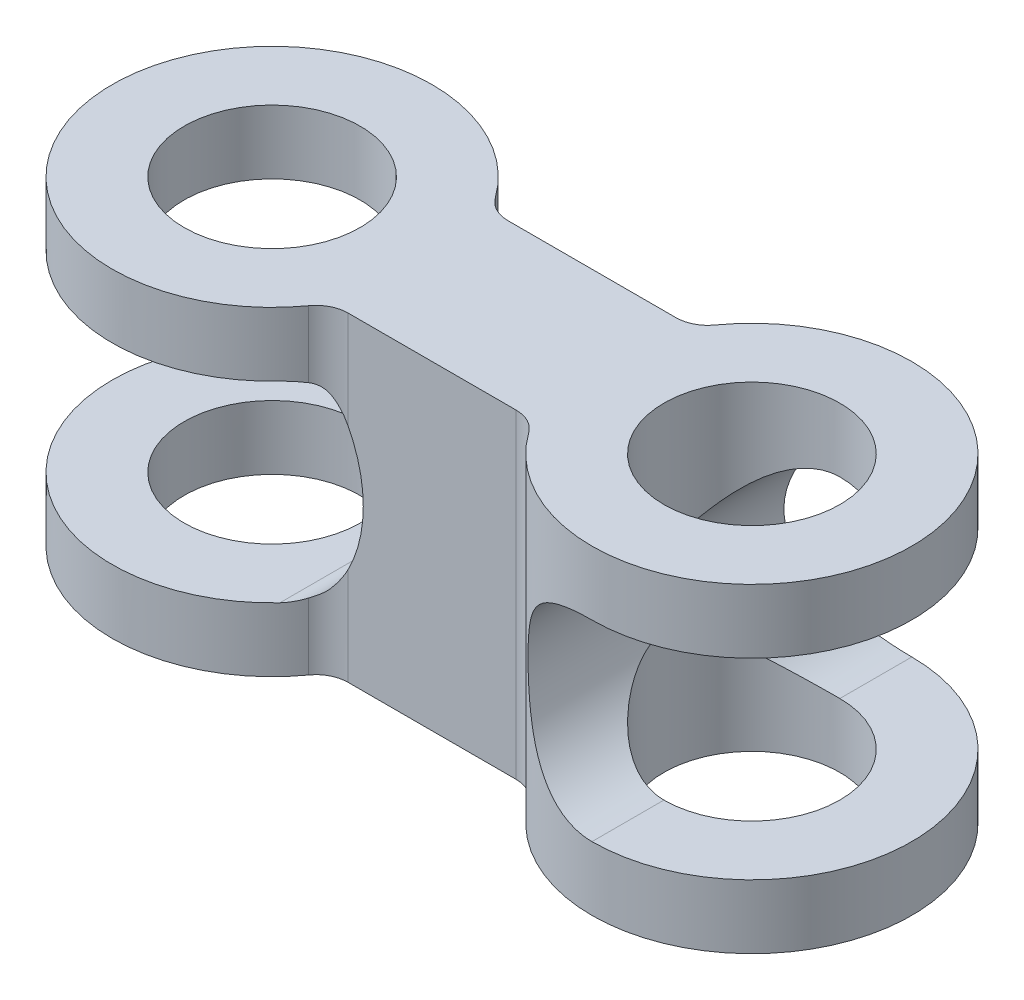
from build123d import *

# Parameters (mm, degrees)
SKETCH1_W               = 7.5
SKETCH1_H               = 5
BOSS_EXTRUDE1_DEPTH     = 10
SKETCH2_R               = 5
BOSS_EXTRUDE2_DEPTH     = 10
CUT_EXTRUDE1_REACH      = 15.463
SKETCH3_R               = 2.75
CUT_EXTRUDE2_DEPTH      = 14.462912018
CUT_EXTRUDE2_DEPTH_BACK = 14.462912018
FILLET1_R               = 1
FILLET3_R               = 1
FILLET4_R               = 1
FILLET1_OF_MIRROR1_R    = 1
CUT_EXTRUDE3_DEPTH      = 23.91287854
CUT_EXTRUDE3_DEPTH_BACK = 23.91287854


with BuildPart() as part:
    # Sketch1 → Boss-Extrude1 (new body)
    with BuildSketch(Plane(origin=(0, 0, 0), x_dir=(1, 0, 0), z_dir=(0, 1, 0))):
        with Locations((3.75, 0)):
            Rectangle(SKETCH1_W, SKETCH1_H)
    boss_extrude1 = extrude(amount=BOSS_EXTRUDE1_DEPTH)

    # Sketch2 → Boss-Extrude2 (add)
    with BuildSketch(Plane(origin=(0, 0, 0), x_dir=(1, 0, 0), z_dir=(0, 1, 0))):
        Circle(SKETCH2_R)
    boss_extrude2 = extrude(amount=BOSS_EXTRUDE2_DEPTH)

    # Sketch3 → Cut-Extrude1 (cut, up to next)
    with BuildSketch(Plane(origin=(0, 0, 0), x_dir=(1, 0, 0), z_dir=(0, 1, 0)), mode=Mode.PRIVATE) as cut_extrude1_sk1:
        with Locations(Location((0, 0, 0), (0, 0, 270))):
            Circle(SKETCH3_R)
    cut_extrude1_tool1 = extrude(cut_extrude1_sk1.sketch, amount=CUT_EXTRUDE1_REACH, mode=Mode.PRIVATE) & part.part
    cut_extrude1 = cut_extrude1_tool1.solids().sort_by_distance((0, 0, 0))[0]
    add(cut_extrude1, mode=Mode.SUBTRACT)

    # Sketch4 → Cut-Extrude2 (cut, two sides: drawn at the far end of the back side and taken through both)
    with BuildSketch(Plane.XY.offset(-CUT_EXTRUDE2_DEPTH_BACK)):
        with BuildLine():
            Line((0, 8), (-5, 8))
            Line((-5, 8), (-5, 2))
            Line((-5, 2), (0, 2))
            Line((0, 2), (4.1, 2))
            ThreePointArc((4.1, 2), (5.35, 5), (4.1, 8))
            Line((4.1, 8), (0, 8))
        make_face()
    extrude(amount=CUT_EXTRUDE2_DEPTH + CUT_EXTRUDE2_DEPTH_BACK, mode=Mode.SUBTRACT)

    # Fillet1
    fillet1_edges = [part.edges().sort_by_distance(p)[0] for p in [
        (4.330127019, 8.876388916, -2.5),
        (4.330127019, 1.123611084, 2.5),
    ]]
    fillet(fillet1_edges, radius=FILLET1_R)

    # Fillet3
    fillet3_edges = [part.edges().sort_by_distance(p)[0] for p in [
        (4.1, 2, 0.002130312),
        (4.1, 8, -0.002130312),
    ]]
    fillet(fillet3_edges, radius=FILLET3_R)

    # Fillet4
    fillet4_edges = [part.edges().sort_by_distance(p)[0] for p in [
        (4.330127019, 1.131174119, -2.5),
        (4.330127019, 8.868825881, 2.5),
    ]]
    fillet(fillet4_edges, radius=FILLET4_R)

    # Mirror1: Boss-Extrude1, Boss-Extrude2, Cut-Extrude1 across plane
    add(boss_extrude1.mirror(Plane(origin=(7.5, 10, -2.5), x_dir=(0, 0, 1), z_dir=(-1, 0, 0))))
    add(boss_extrude2.mirror(Plane(origin=(7.5, 10, -2.5), x_dir=(0, 0, 1), z_dir=(-1, 0, 0))))
    add(cut_extrude1.mirror(Plane(origin=(7.5, 10, -2.5), x_dir=(0, 0, 1), z_dir=(-1, 0, 0))), mode=Mode.SUBTRACT)

    # Fillet1 of Mirror1
    fillet1_of_mirror1_edges = [part.edges().sort_by_distance(p)[0] for p in [
        (10.669872981, 8.876388916, -2.5),
        (10.669872981, 1.123611084, 2.5),
    ]]
    fillet(fillet1_of_mirror1_edges, radius=FILLET1_OF_MIRROR1_R)

    # Sketch6 → Cut-Extrude3 (cut, two sides: drawn at the far end of the back side and taken through both)
    with BuildSketch(Plane.XY.offset(-CUT_EXTRUDE3_DEPTH_BACK)):
        with BuildLine():
            Line((15, 8), (20, 8))
            Line((20, 8), (20, 2))
            Line((20, 2), (15, 2))
            ThreePointArc((15, 2), (12, 5), (15, 8))
        make_face()
    extrude(amount=CUT_EXTRUDE3_DEPTH + CUT_EXTRUDE3_DEPTH_BACK, mode=Mode.SUBTRACT)


solid = part.part
